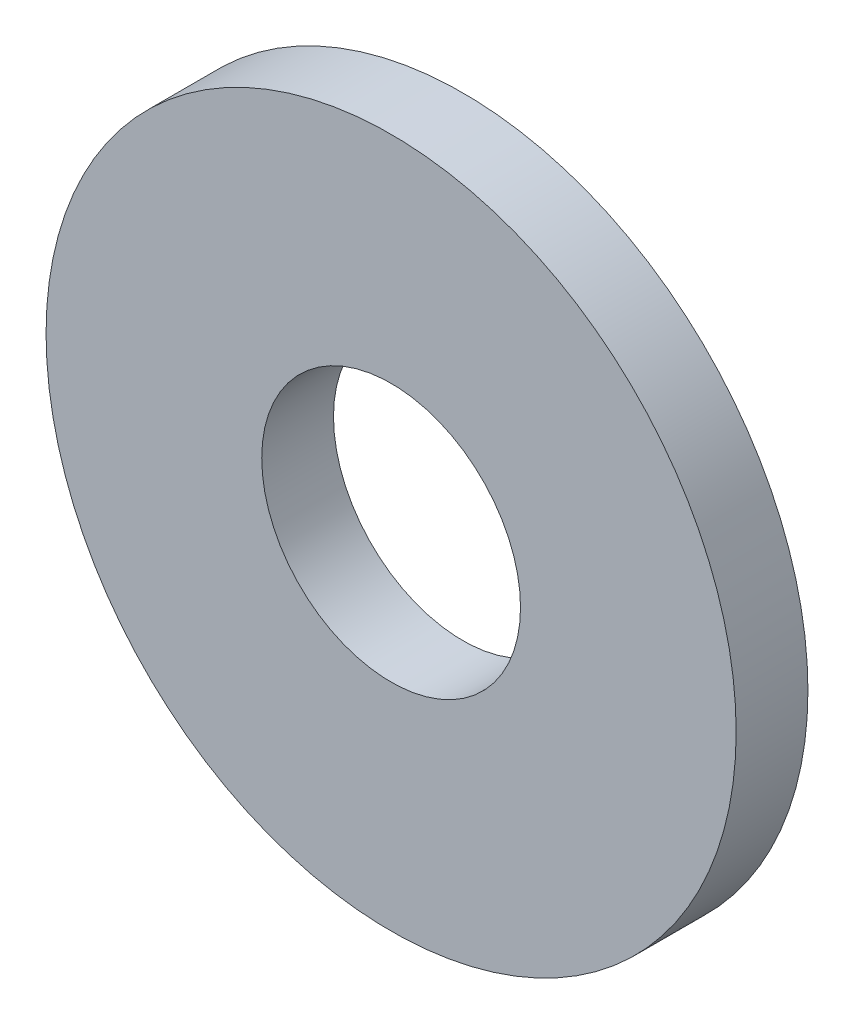
from build123d import *

# Parameters (mm, degrees)
SKETCH2_R           = 12.7
SKETCH2_R_2         = 4.7625
BOSS_EXTRUDE1_DEPTH = 1.3208


with BuildPart() as part:
    # Sketch2 → Boss-Extrude1 (new, symmetric)
    with BuildSketch(Plane.XY):
        Circle(SKETCH2_R)
        Circle(SKETCH2_R_2, mode=Mode.SUBTRACT)
    extrude(amount=BOSS_EXTRUDE1_DEPTH, both=True)


solid = part.part
